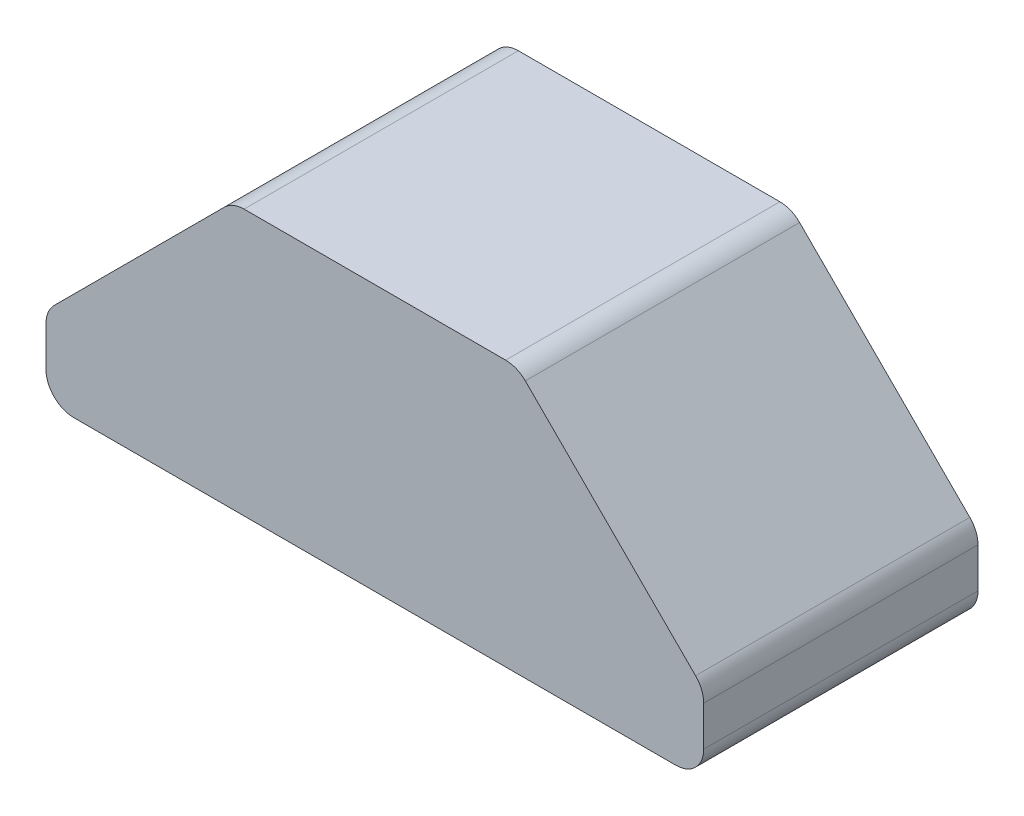
from build123d import *

# Parameters (mm, degrees)
P_IDAT_VYSUNUT_M1_DEPTH = 5


with BuildPart() as part:
    # Skica1 → Přidat vysunutím1 (new body)
    with BuildSketch(Plane.XY):
        with BuildLine():
            Line((17.662287798, -11.471059771), (11.386287798, -11.471059771))
            Line((11.386287798, -11.471059771), (9.037287798, -11.471059771))
            ThreePointArc((9.037287798, -11.471059771), (8.678077553, -11.322270016), (8.529287798, -10.963059771))
            Line((8.529287798, -10.963059771), (8.529287798, -10.237140432))
            ThreePointArc((8.529287798, -10.237140432), (8.567956995, -10.042737249), (8.678077553, -9.877930187))
            Line((8.678077553, -9.877930187), (11.781158214, -6.774849526))
            ThreePointArc((11.781158214, -6.774849526), (11.945965275, -6.664728968), (12.140368459, -6.626059771))
            Line((12.140368459, -6.626059771), (16.908207136, -6.626059771))
            ThreePointArc((16.908207136, -6.626059771), (17.10261032, -6.664728968), (17.267417381, -6.774849526))
            Line((17.267417381, -6.774849526), (20.370498042, -9.877930187))
            ThreePointArc((20.370498042, -9.877930187), (20.4806186, -10.042737249), (20.519287798, -10.237140432))
            Line((20.519287798, -10.237140432), (20.519287798, -10.963059771))
            ThreePointArc((20.519287798, -10.963059771), (20.370498042, -11.322270016), (20.011287798, -11.471059771))
            Line((20.011287798, -11.471059771), (17.662287798, -11.471059771))
        make_face()
    extrude(amount=-P_IDAT_VYSUNUT_M1_DEPTH)


solid = part.part
